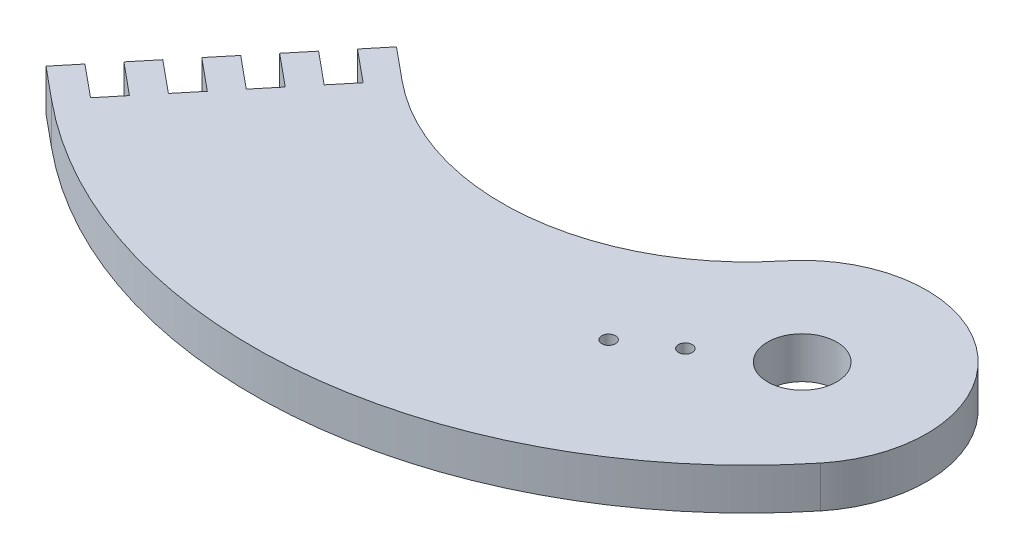
from build123d import *

# Parameters (mm, degrees)
SKETCH1_R           = 2.5
SKETCH1_R_2         = 0.5
BOSS_EXTRUDE1_DEPTH = 3


with BuildPart() as part:
    # Sketch1 → Boss-Extrude1 (new body)
    with BuildSketch(Plane(origin=(0, 0, 0), x_dir=(1, 0, 0), z_dir=(0, 1, 0))):
        with BuildLine():
            Line((-33.358616029, 1.612959212), (-34.632118724, 0.070820799))
            Line((-34.632118724, 0.070820799), (-36.945326344, 1.981074841))
            Line((-36.945326344, 1.981074841), (-38.218829039, 0.438936428))
            Line((-38.218829039, 0.438936428), (-35.905621419, -1.471317615))
            Line((-35.905621419, -1.471317615), (-37.179124114, -3.013456028))
            Line((-37.179124114, -3.013456028), (-39.492331734, -1.103201985))
            Line((-39.492331734, -1.103201985), (-40.765834429, -2.645340399))
            Line((-40.765834429, -2.645340399), (-38.452626808, -4.555594441))
            Line((-38.452626808, -4.555594441), (-39.726129503, -6.097732855))
            Line((-39.726129503, -6.097732855), (-42.039337123, -4.187478812))
            Line((-42.039337123, -4.187478812), (-43.312839818, -5.729617226))
            Line((-43.312839818, -5.729617226), (-40.999632198, -7.639871268))
            Line((-40.999632198, -7.639871268), (-42.273134893, -9.182009681))
            Line((-42.273134893, -9.182009681), (-44.586342513, -7.271755639))
            Line((-44.586342513, -7.271755639), (-45.859845208, -8.813894052))
            Line((-45.859845208, -8.813894052), (-43.546637588, -10.724148095))
            ThreePointArc((-43.546637588, -10.724148095), (-17.222782933, -18.730729797), (6.992336159, -5.66632465))
            ThreePointArc((6.992336159, -5.66632465), (5.66632465, 6.992336159), (-6.992336159, 5.66632465))
            ThreePointArc((-6.992336159, 5.66632465), (-19.015227456, -0.820198185), (-32.085113334, 3.155097626))
            Line((-32.085113334, 3.155097626), (-34.398320954, 5.065351668))
            Line((-34.398320954, 5.065351668), (-35.671823649, 3.523213255))
            Line((-35.671823649, 3.523213255), (-33.358616029, 1.612959212))
        make_face()
        with Locations(Location((0, 0, 0), (0, 0, 270))):
            Circle(SKETCH1_R, mode=Mode.SUBTRACT)
        with Locations(Location((-5.06424038, -3.382538894, 0), (0, 0, 270))):
            Circle(SKETCH1_R_2, mode=Mode.SUBTRACT)
        with Locations(Location((-8.39050664, -5.604239317, 0), (0, 0, 270))):
            Circle(SKETCH1_R_2, mode=Mode.SUBTRACT)
    extrude(amount=BOSS_EXTRUDE1_DEPTH)


solid = part.part
